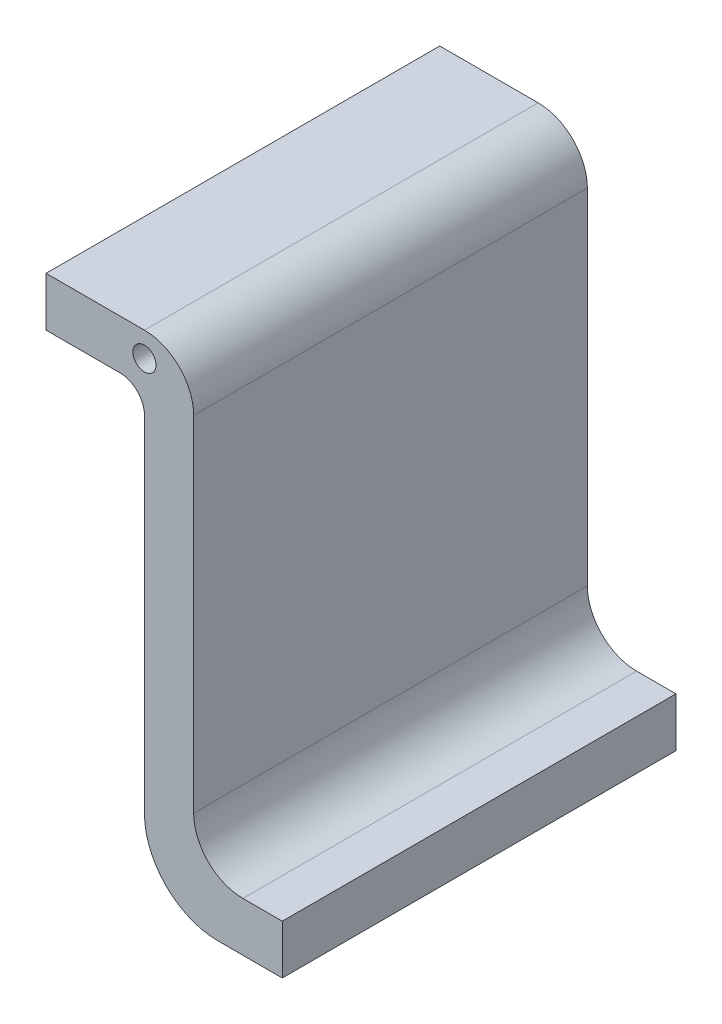
from build123d import *

# Parameters (mm, degrees)
SALIENTE_EXTRUIR3_DEPTH = 80
CROQUIS2_R              = 2.35
CORTAR_EXTRUIR1_DEPTH   = 5
CORTAR_EXTRUIR2_START   = -5
CROQUIS3_R              = 2.35
CORTAR_EXTRUIR2_DEPTH   = 5
REDONDEO1_R             = 15
REDONDEO3_R             = 5


with BuildPart() as part:
    # Croquis1 → Saliente-Extruir3 (new body)
    with BuildSketch(Plane.XY):
        with BuildLine():
            Line((0, 0), (20, 0))
            ThreePointArc((20, 0), (27.071067812, -2.928932188), (30, -10))
            Line((30, -10), (30, -80))
            ThreePointArc((30, -80), (32.928932188, -87.071067812), (40, -90))
            Line((40, -90), (48, -90))
            Line((48, -90), (48, -100))
            Line((48, -100), (20, -100))
            Line((20, -100), (20, -10))
            Line((20, -10), (0, -10))
            Line((0, -10), (0, 0))
        make_face()
    extrude(amount=-SALIENTE_EXTRUIR3_DEPTH)

    # Croquis2 → Cortar-Extruir1 (cut)
    with BuildSketch(Plane.XY):
        with Locations((20, -5)):
            Circle(CROQUIS2_R)
    extrude(amount=-CORTAR_EXTRUIR1_DEPTH, mode=Mode.SUBTRACT)

    # Croquis3 → Cortar-Extruir2 (cut)
    with BuildSketch(Plane(origin=(0, 0, -80), x_dir=(-1, 0, 0), z_dir=(0, 0, -1)).offset(CORTAR_EXTRUIR2_START)):
        with Locations(Location((-20, -5, 0), (0, 0, 180))):
            Circle(CROQUIS3_R)
    extrude(amount=CORTAR_EXTRUIR2_DEPTH, mode=Mode.SUBTRACT)

    # Redondeo1
    redondeo1_edges = [part.edges().sort_by_distance(p)[0] for p in [
        (20, -100, -40),
    ]]
    fillet(redondeo1_edges, radius=REDONDEO1_R)

    # Redondeo3
    redondeo3_edges = [part.edges().sort_by_distance(p)[0] for p in [
        (20, -10, -40),
    ]]
    fillet(redondeo3_edges, radius=REDONDEO3_R)


solid = part.part
